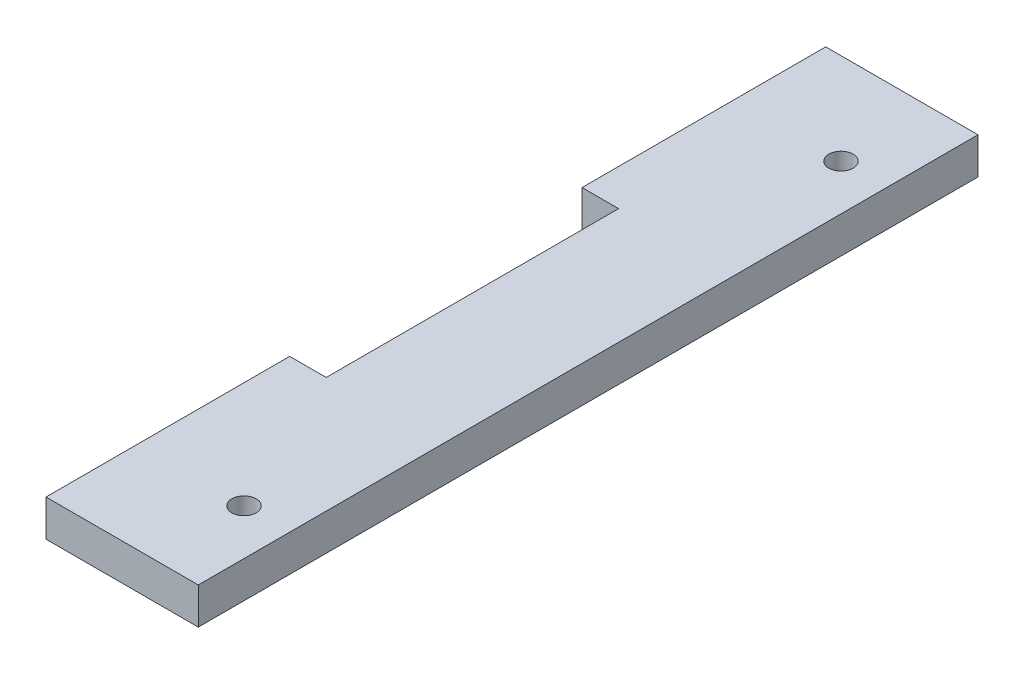
from build123d import *

# Parameters (mm, degrees)
BOSS_EXTRUDE1_DEPTH = 6
SKETCH2_R           = 2
CUT_EXTRUDE1_DEPTH  = 68.982084447


with BuildPart() as part:
    # Sketch1 → Boss-Extrude1 (new body)
    with BuildSketch(Plane(origin=(0, 0, 0), x_dir=(1, 0, 0), z_dir=(0, 1, 0))):
        Polygon((-13.316216216, 61.605405405), (-13.316216216, 21.605405405), (-7.316216216, 21.605405405), (-7.316216216, -26.394594595), (-13.316216216, -26.394594595), (-13.316216216, -66.394594595), (11.683783784, -66.394594595), (11.683783784, 61.605405405), align=None)
    extrude(amount=BOSS_EXTRUDE1_DEPTH)

    # Sketch2 → Cut-Extrude1 (cut, through all)
    with BuildSketch(Plane(origin=(0, 6, 0), x_dir=(1, 0, 0), z_dir=(0, 1, 0))):
        with Locations((4.183783784, -51.394594595)):
            Circle(SKETCH2_R)
        with Locations((4.183783784, 46.605405405)):
            Circle(SKETCH2_R)
    extrude(amount=-CUT_EXTRUDE1_DEPTH, mode=Mode.SUBTRACT)


solid = part.part
